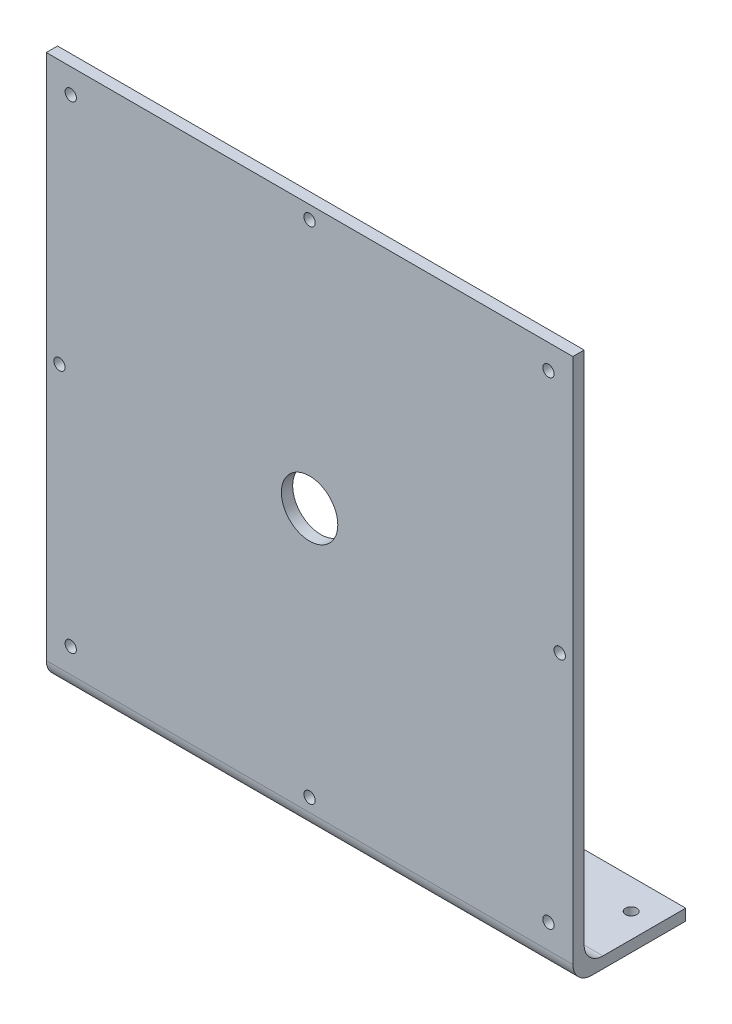
from build123d import *

# Parameters (mm, degrees)
SKICA1_W                 = 140
SKICA1_H                 = 145
SKICA1_R                 = 1.5
P_IDAT_VYSUNUT_M1_DEPTH  = 3
SKICA2_W                 = 140
SKICA2_H                 = 30
P_IDAT_VYSUNUT_M2_DEPTH  = 3
SKICA3_R                 = 1.5
ODEBRAT_VYSUNUT_M1_DEPTH = 161.601992516
ZAOBLIT1_R               = 5
SKICA4_R                 = 7.5
SKICA4_R_2               = 1.5
ODEBRAT_VYSUNUT_M2_DEPTH = 106.148704224


with BuildPart() as part:
    # Skica1 → Přidat vysunutím1 (new body)
    with BuildSketch(Plane.XY):
        Rectangle(SKICA1_W, SKICA1_H)
        with Locations((-63.5, 66)):
            Circle(SKICA1_R, mode=Mode.SUBTRACT)
        with Locations((-66.5, 2.5)):
            Circle(SKICA1_R, mode=Mode.SUBTRACT)
        with Locations(Location((63.5, 66, 0), (0, 0, 180))):
            Circle(SKICA1_R, mode=Mode.SUBTRACT)
        with Locations(Location((66.5, 2.5, 0), (0, 0, 180))):
            Circle(SKICA1_R, mode=Mode.SUBTRACT)
        with Locations((63.5, -61)):
            Circle(SKICA1_R, mode=Mode.SUBTRACT)
        with Locations(Location((-63.5, -61, 0), (0, 0, 180))):
            Circle(SKICA1_R, mode=Mode.SUBTRACT)
    extrude(amount=P_IDAT_VYSUNUT_M1_DEPTH)

    # Skica2 → Přidat vysunutím2 (add)
    with BuildSketch(Plane.XZ.offset(72.5)):
        with Locations((0, -12)):
            Rectangle(SKICA2_W, SKICA2_H)
    extrude(amount=-P_IDAT_VYSUNUT_M2_DEPTH)

    # Skica3 → Odebrat vysunutím1 (cut, through all)
    with BuildSketch(Plane(origin=(0, -69.5, 0), x_dir=(1, 0, 0), z_dir=(0, 1, 0))):
        with Locations(Location((-63.5, 19, 0), (0, 0, 270))):
            Circle(SKICA3_R)
        with Locations(Location((63.5, 19, 0), (0, 0, 90))):
            Circle(SKICA3_R)
    extrude(amount=-ODEBRAT_VYSUNUT_M1_DEPTH, mode=Mode.SUBTRACT)

    # Zaoblit1
    zaoblit1_edges = [part.edges().sort_by_distance(p)[0] for p in [
        (0, -72.5, 3),
        (0, -69.5, 0),
    ]]
    fillet(zaoblit1_edges, radius=ZAOBLIT1_R)

    # Skica4 → Odebrat vysunutím2 (cut, through all)
    with BuildSketch(Plane.XY.offset(3)):
        with Locations((0, 2.5)):
            Circle(SKICA4_R)
        with Locations((0, 69)):
            Circle(SKICA4_R_2)
        with Locations(Location((0, -64, 0), (0, 0, 340.528779366))):
            Circle(SKICA4_R_2)
    extrude(amount=-ODEBRAT_VYSUNUT_M2_DEPTH, mode=Mode.SUBTRACT)


solid = part.part
